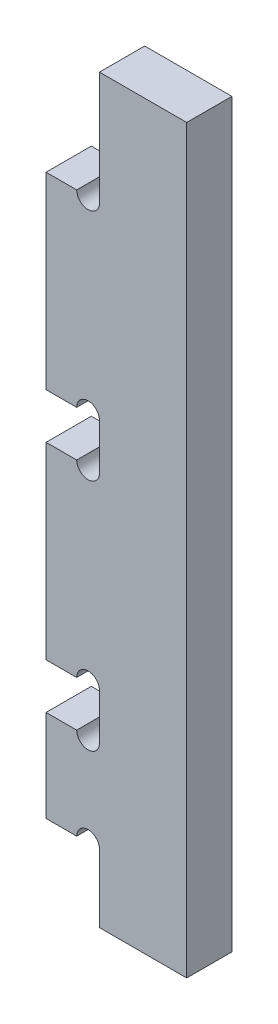
from build123d import *

# Parameters (mm, degrees)
BOSS_EXTRUDE1_DEPTH = 12.7
CUT_EXTRUDE1_DEPTH  = 314.689643597
LPATTERN1_COUNT     = 3
LPATTERN1_PITCH     = 65.7


with BuildPart() as part:
    # Sketch1 → Boss-Extrude1 (new body)
    with BuildSketch(Plane.XY):
        with BuildLine():
            Line((210.5, 170), (210.5, 0))
            Line((210.5, 0), (219.1, 0))
            ThreePointArc((219.1, 0), (222.3, 3.2), (225.5, 0))
            Line((225.5, 0), (225.5, -19.05))
            Line((225.5, -19.05), (250, -19.05))
            Line((250, -19.05), (250, 0))
            Line((250, 0), (250, 170))
            Line((250, 170), (250, 189.05))
            Line((250, 189.05), (225.5, 189.05))
            Line((225.5, 189.05), (225.5, 170))
            ThreePointArc((225.5, 170), (222.3, 166.8), (219.1, 170))
            Line((219.1, 170), (210.5, 170))
        make_face()
    extrude(amount=BOSS_EXTRUDE1_DEPTH)

    # Sketch2 → Cut-Extrude1 (cut, through all)
    with BuildSketch(Plane.XY.offset(12.7)):
        with BuildLine():
            Line((210.5, 157.2), (210.5, 170))
            Line((210.5, 170), (219.1, 170))
            ThreePointArc((219.1, 170), (222.3, 173.2), (225.5, 170))
            Line((225.5, 170), (225.5, 157.2))
            ThreePointArc((225.5, 157.2), (222.3, 154), (219.1, 157.2))
            Line((219.1, 157.2), (210.5, 157.2))
        make_face()
    cut_extrude1 = extrude(amount=-CUT_EXTRUDE1_DEPTH, mode=Mode.SUBTRACT)

    # LPattern1: Cut-Extrude1 ×3
    with Locations(*[(0, -i * LPATTERN1_PITCH, 0) for i in range(1, LPATTERN1_COUNT)]):
        add(cut_extrude1, mode=Mode.SUBTRACT)


solid = part.part
